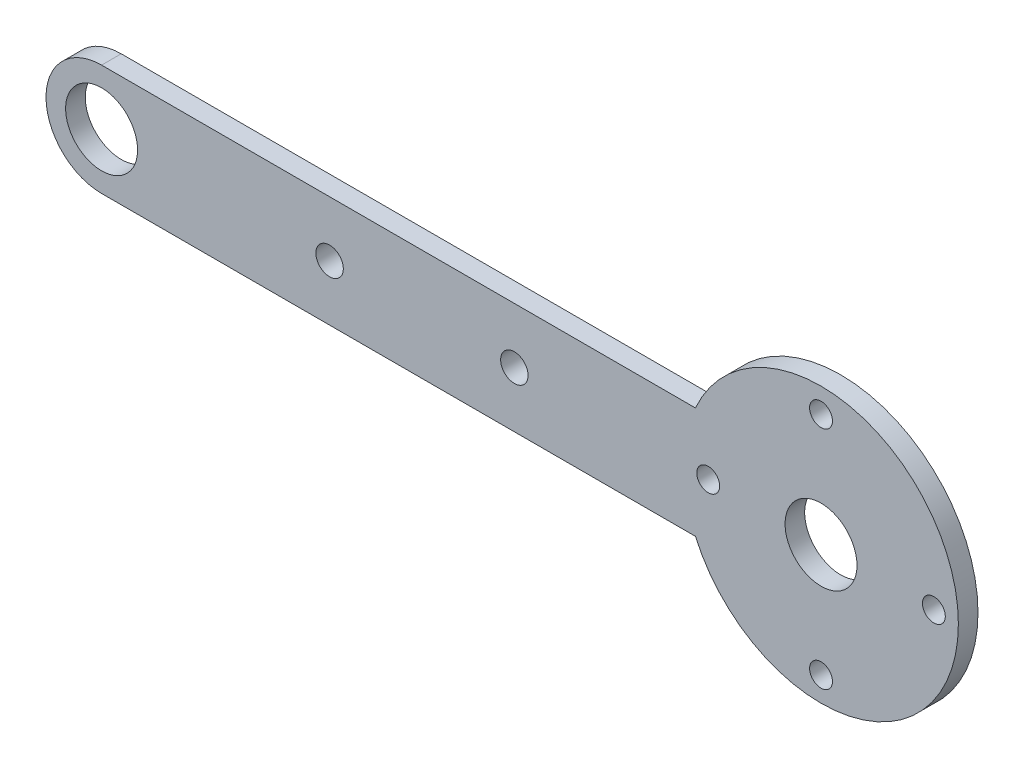
from build123d import *

# Parameters (mm, degrees)
ESQUISSE1_R        = 5.5
ESQUISSE1_R_2      = 1.75
ESQUISSE1_R_3      = 2.1
BOSS_EXTRU_1_DEPTH = 3


with BuildPart() as part:
    # Esquisse1 → Boss.-Extru.1 (new body)
    with BuildSketch(Plane.XY):
        with BuildLine():
            Line((-110, 8.5), (-19.20286437, 8.5))
            ThreePointArc((-19.20286437, 8.5), (21, 0), (-19.20286437, -8.5))
            Line((-19.20286437, -8.5), (-110, -8.5))
            ThreePointArc((-110, -8.5), (-118.5, 0), (-110, 8.5))
        make_face()
        with Locations((-110, 0)):
            Circle(ESQUISSE1_R, mode=Mode.SUBTRACT)
        Circle(ESQUISSE1_R, mode=Mode.SUBTRACT)
        with Locations((0, 17.25)):
            Circle(ESQUISSE1_R_2, mode=Mode.SUBTRACT)
        with Locations((17.25, 0)):
            Circle(ESQUISSE1_R_2, mode=Mode.SUBTRACT)
        with Locations((0, -17.25)):
            Circle(ESQUISSE1_R_2, mode=Mode.SUBTRACT)
        with Locations((-17.25, 0)):
            Circle(ESQUISSE1_R_2, mode=Mode.SUBTRACT)
        with Locations((-75.14, 0)):
            Circle(ESQUISSE1_R_3, mode=Mode.SUBTRACT)
        with Locations((-46.89, 0)):
            Circle(ESQUISSE1_R_3, mode=Mode.SUBTRACT)
    extrude(amount=BOSS_EXTRU_1_DEPTH)


solid = part.part
